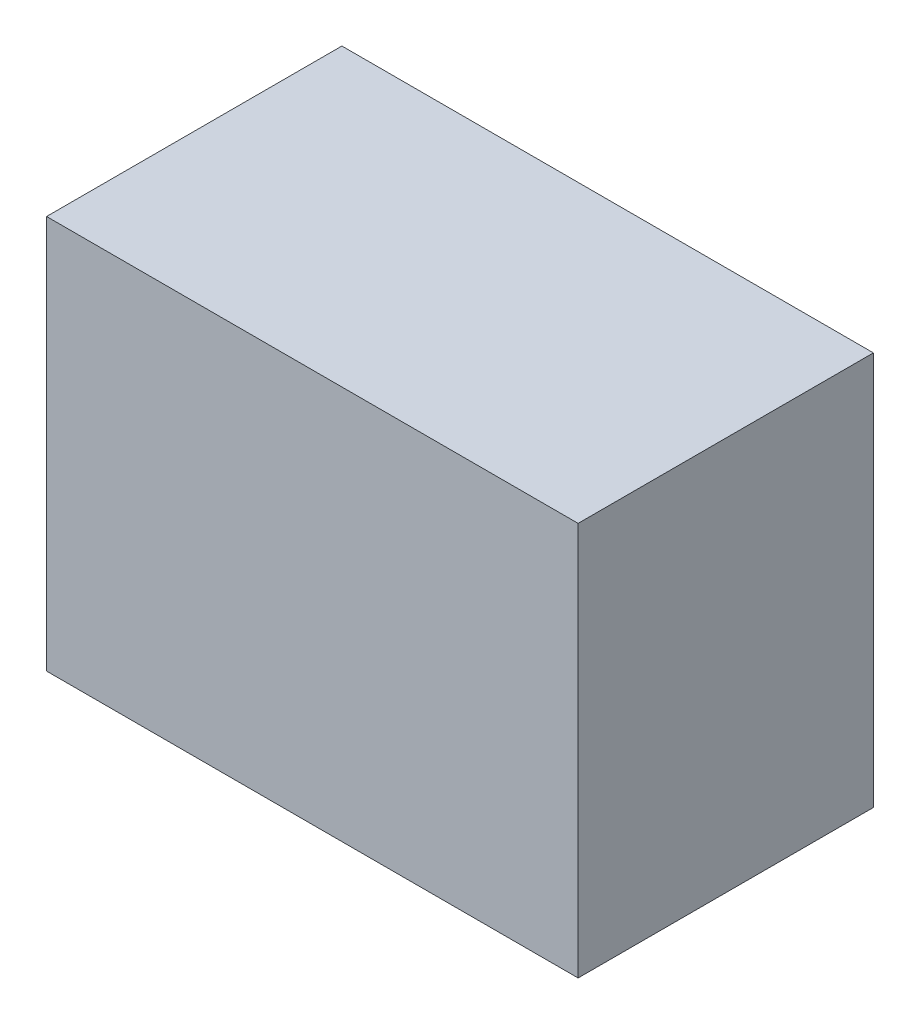
from build123d import *

# Parameters (mm, degrees)
SKETCH1_W           = 270
SKETCH1_H           = 150
BOSS_EXTRUDE1_DEPTH = 200


with BuildPart() as part:
    # Sketch1 → Boss-Extrude1 (new body)
    with BuildSketch(Plane(origin=(0, -8.241432606, 0), x_dir=(1, 0, 0), z_dir=(0, 1, 0))):
        Rectangle(SKETCH1_W, SKETCH1_H)
    extrude(amount=BOSS_EXTRUDE1_DEPTH)


solid = part.part
